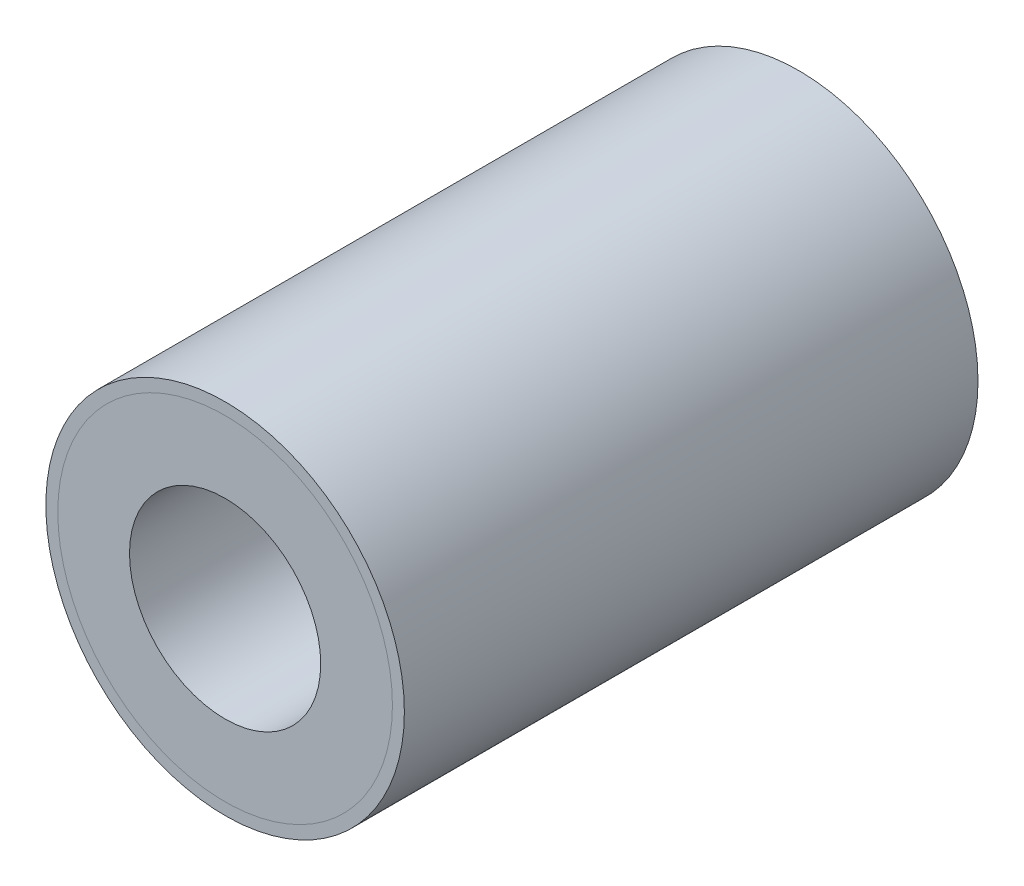
from build123d import *

# Parameters (mm, degrees)
SKETCH1_R           = 7
SKETCH1_R_2         = 4
BOSS_EXTRUDE1_DEPTH = 24
SKETCH1_3_R         = 7.5
SKETCH1_3_R_2       = 7
BOSS_EXTRUDE2_DEPTH = 24


with BuildPart() as part:
    # Sketch1 → Boss-Extrude1 (new body)
    with BuildSketch(Plane.XY):
        Circle(SKETCH1_R)
        Circle(SKETCH1_R_2, mode=Mode.SUBTRACT)
    extrude(amount=BOSS_EXTRUDE1_DEPTH)


with BuildPart() as body_2:
    # Sketch1<3> → Boss-Extrude2 (new body)
    with BuildSketch(Plane.XY):
        Circle(SKETCH1_3_R)
        Circle(SKETCH1_3_R_2, mode=Mode.SUBTRACT)
    extrude(amount=BOSS_EXTRUDE2_DEPTH)


solid = Compound([part.part, body_2.part])
